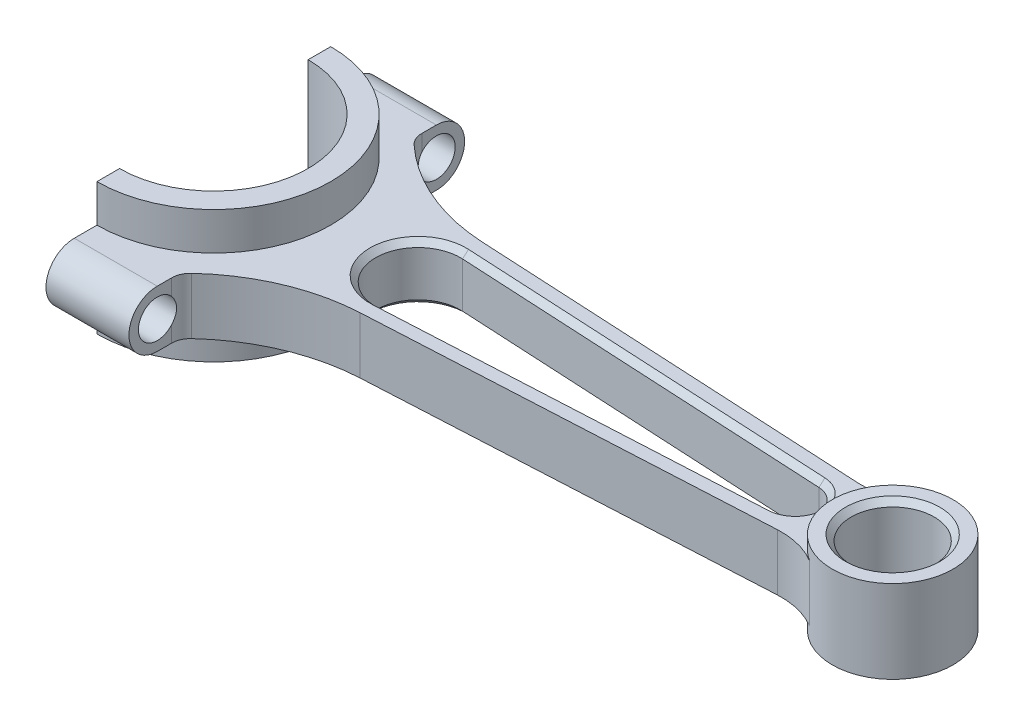
from build123d import *

# Parameters (mm, degrees)
SKETCH1_R           = 16
SKETCH1_R_2         = 11
BOSS_EXTRUDE1_DEPTH = 11
BOSS_EXTRUDE2_DEPTH = 17.5
BOSS_EXTRUDE3_DEPTH = 7.5
CHAMFER1_SIZE       = 1.5
FILLET1_RADIUS      = 7.5
FILLET1_LENGTH      = 22
FILLET2_RADIUS      = 7.5
FILLET2_LENGTH      = 22
SKETCH2_R           = 5
CUT_EXTRUDE1_DEPTH  = 202.748605943


with BuildPart() as part:
    # Sketch1 → Boss-Extrude1 (new, symmetric)
    with BuildSketch(Plane(origin=(0, 0, 0), x_dir=(1, 0, 0), z_dir=(0, 1, 0))):
        with Locations(Location((180, 0, 0), (0, 0, 270))):
            Circle(SKETCH1_R)
        with Locations(Location((180, 0, 0), (0, 0, 270))):
            Circle(SKETCH1_R_2, mode=Mode.SUBTRACT)
    extrude(amount=BOSS_EXTRUDE1_DEPTH, both=True)



with BuildPart() as body_2:
    # Sketch1<3> → Boss-Extrude2 (new, symmetric)
    with BuildSketch(Plane(origin=(0, 0, 0), x_dir=(1, 0, 0), z_dir=(0, 1, 0))):
        with BuildLine():
            Line((0, 31), (0, 25))
            ThreePointArc((0, 25), (25, 0), (0, -25))
            Line((0, -25), (0, -31))
            ThreePointArc((0, -31), (31, 0), (0, 31))
        make_face()
    extrude(amount=BOSS_EXTRUDE2_DEPTH, both=True)


with BuildPart() as part_1:
    add(part.part)

    add(body_2.part)  # Boss-Extrude3 merges body 2
    # Sketch1<4> → Boss-Extrude3 (add, symmetric)
    with BuildSketch(Plane(origin=(0, 0, 0), x_dir=(1, 0, 0), z_dir=(0, 1, 0))):
        with BuildLine():
            Line((0, 44.5), (0, 31))
            ThreePointArc((0, 31), (31, 0), (0, -31))
            Line((0, -31), (0, -44.5))
            Line((0, -44.5), (22, -44.5))
            Line((22, -44.5), (22, -33.163866466))
            ThreePointArc((22, -33.163866466), (22.416915225, -31.165033321), (23.598133576, -29.499537764))
            ThreePointArc((23.598133576, -29.499537764), (38.131334863, -20.095927671), (55, -16.211348046))
            Line((55, -16.211348046), (154.726094768, -10.984924882))
            Line((154.726094768, -10.984924882), (160.111143378, -10.702706443))
            ThreePointArc((160.111143378, -10.702706443), (166.09109505, -11.293263792), (171.625716668, -13.633465395))
            ThreePointArc((171.625716668, -13.633465395), (164, 0), (171.625716668, 13.633465395))
            ThreePointArc((171.625716668, 13.633465395), (166.09109505, 11.293263792), (160.111143378, 10.702706443))
            Line((160.111143378, 10.702706443), (154.726094768, 10.984924882))
            Line((154.726094768, 10.984924882), (55, 16.211348046))
            ThreePointArc((55, 16.211348046), (38.131334863, 20.095927671), (23.598133576, 29.499537764))
            ThreePointArc((23.598133576, 29.499537764), (22.416915225, 31.165033321), (22, 33.163866466))
            Line((22, 33.163866466), (22, 44.5))
            Line((22, 44.5), (0, 44.5))
        make_face()
        with BuildLine():
            Line((54.738320219, 11.218200372), (154.464414987, 5.991777209))
            ThreePointArc((154.464414987, 5.991777209), (160.15039925, 0), (154.464414987, -5.991777209))
            Line((154.464414987, -5.991777209), (54.738320219, -11.218200372))
            ThreePointArc((54.738320219, -11.218200372), (42.916803625, 0), (54.738320219, 11.218200372))
        make_face(mode=Mode.SUBTRACT)
    extrude(amount=BOSS_EXTRUDE3_DEPTH, both=True)

    # Chamfer1
    chamfer1_edges = [part_1.edges().sort_by_distance(p)[0] for p in [
        (160.15039925, 7.5, 0),
        (104.601367603, -7.5, 8.60498879),
        (42.916803625, 7.5, 0),
        (104.601367603, 7.5, -8.60498879),
        (104.601367603, 7.5, 8.60498879),
        (160.15039925, -7.5, 0),
        (104.601367603, -7.5, -8.60498879),
        (42.916803625, -7.5, 0),
        (180, -11, -11),
        (180, 11, -11),
    ]]
    chamfer(chamfer1_edges, length=CHAMFER1_SIZE)

    # Fillet1: full round fillet: the end face becomes a half cylinder, R = half its width
    fillet1_face = Plane((11, 0, 44.5), x_dir=(1, 0, 0), z_dir=(0, 0, 1))  # on the end face: x along it, z out of the body
    fillet1_slab = fillet1_face.offset(-FILLET1_RADIUS / 2) * Box(FILLET1_LENGTH, 2 * FILLET1_RADIUS, FILLET1_RADIUS, mode=Mode.PRIVATE)  # the body's end, R deep
    fillet1_round = Plane((11, 0, 37), x_dir=(0, 0, 1), z_dir=(1, 0, 0)) * Cylinder(FILLET1_RADIUS, FILLET1_LENGTH, mode=Mode.PRIVATE)  # its axis R under the face
    add(fillet1_slab - fillet1_round, mode=Mode.SUBTRACT)

    # Fillet2: full round fillet: the end face becomes a half cylinder, R = half its width
    fillet2_face = Plane((11, 0, -44.5), x_dir=(1, 0, 0), z_dir=(0, 0, -1))  # on the end face: x along it, z out of the body
    fillet2_slab = fillet2_face.offset(-FILLET2_RADIUS / 2) * Box(FILLET2_LENGTH, 2 * FILLET2_RADIUS, FILLET2_RADIUS, mode=Mode.PRIVATE)  # the body's end, R deep
    fillet2_round = Plane((11, 0, -37), x_dir=(0, 0, -1), z_dir=(1, 0, 0)) * Cylinder(FILLET2_RADIUS, FILLET2_LENGTH, mode=Mode.PRIVATE)  # its axis R under the face
    add(fillet2_slab - fillet2_round, mode=Mode.SUBTRACT)

    # Sketch2 → Cut-Extrude1 (cut, through all)
    with BuildSketch(Plane.ZY):
        with Locations((-37, 0)):
            Circle(SKETCH2_R)
        with Locations((37, 0)):
            Circle(SKETCH2_R)
    extrude(amount=-CUT_EXTRUDE1_DEPTH, mode=Mode.SUBTRACT)


solid = part_1.part
